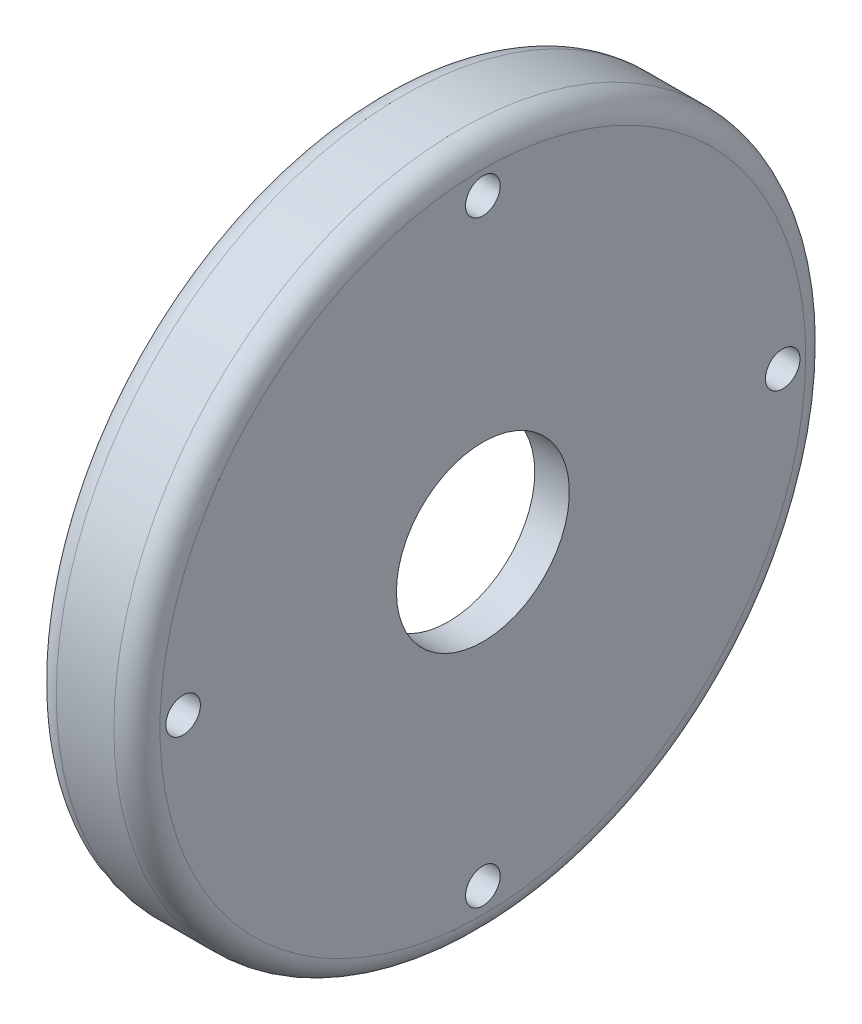
from build123d import *

# Parameters (mm, degrees)
BASPROSKE_W         = 6
BASPROSKE_H         = 10
TOOTHCUT_DEPTH      = 43.848570571
TEETHCUTS_COUNT     = 42
TEETHCUTS_ANGLE     = 351.428571429
BOSS_EXTRUDE1_START = 3
SKETCH1_R           = 30
BOSS_EXTRUDE1_DEPTH = 3
SKETCH2_R           = 1.5
SKETCH2_R_2         = 7.5
CUT_EXTRUDE2_DEPTH  = 44.370496884
FILLET1_R           = 2


with BuildPart() as part:
    # BasProSke → Base-Revolve (revolve)
    with BuildSketch(Plane(origin=(0, 0, 0), x_dir=(1, 0, 0), z_dir=(0, 1, 0)), mode=Mode.PRIVATE) as base_revolve_sk:
        with Locations((3, 25)):
            Rectangle(BASPROSKE_W, BASPROSKE_H)
    revolve(base_revolve_sk.sketch.rotate(Axis((-10, 0, 0), (1, 0, 0)), 180), axis=Axis((-10, 0, 0), (1, 0, 0)))

    # TooCutSke → ToothCut (cut, through all)
    with BuildSketch(Plane(origin=(0, 0, 0), x_dir=(0, 0, -1), z_dir=(1, 0, 0))):
        with BuildLine():
            ThreePointArc((1.22844435, 19.936789351), (0.824190335, 21.121258907), (0.281875348, 22.249214532))
            ThreePointArc((0.281875348, 22.249214532), (0, 22.251), (-0.281875348, 22.249214532))
            ThreePointArc((-0.281875348, 22.249214532), (-0.824190335, 21.121258907), (-1.22844435, 19.936789351))
            ThreePointArc((-1.22844435, 19.936789351), (0, 19.9746), (1.22844435, 19.936789351))
        make_face()
    toothcut = extrude(amount=TOOTHCUT_DEPTH, mode=Mode.SUBTRACT)

    # TeethCuts: ToothCut ×42 about axis
    teethcuts_axis = Axis((-10, 0, 0), (1, 0, 0))
    for i in range(1, TEETHCUTS_COUNT):
        add(toothcut.rotate(teethcuts_axis, i * TEETHCUTS_ANGLE / (TEETHCUTS_COUNT - 1)), mode=Mode.SUBTRACT)

    # Sketch1 → Boss-Extrude1 (add)
    with BuildSketch(Plane(origin=(6, 0, 0), x_dir=(0, 0, -1), z_dir=(1, 0, 0)).offset(BOSS_EXTRUDE1_START)):
        with Locations(Location((0, 0, 0), (0, 0, 180))):
            Circle(SKETCH1_R)
    extrude(amount=-BOSS_EXTRUDE1_DEPTH)

    # Sketch2 → Cut-Extrude2 (cut, through all)
    with BuildSketch(Plane.ZY):
        with Locations((0, 26)):
            Circle(SKETCH2_R)
        with Locations((26, 0)):
            Circle(SKETCH2_R)
        with Locations((-26, 0)):
            Circle(SKETCH2_R)
        with Locations((0, -25.826923014)):
            Circle(SKETCH2_R)
        Circle(SKETCH2_R_2)
    extrude(amount=-CUT_EXTRUDE2_DEPTH, mode=Mode.SUBTRACT)

    # Fillet1
    fillet1_edges = [part.edges().sort_by_distance(p)[0] for p in [
        (0, 0, -30),
        (9, 0, -30),
    ]]
    fillet(fillet1_edges, radius=FILLET1_R)


solid = part.part
